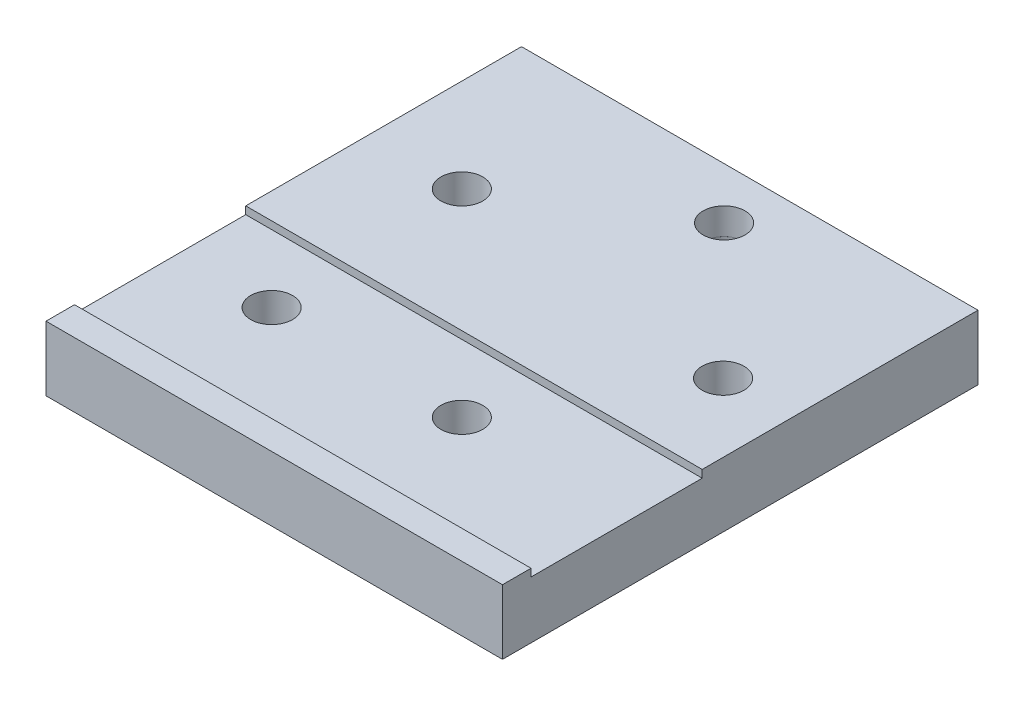
from build123d import *

# Parameters (mm, degrees)
SKETCH1_W           = 120
SKETCH1_H           = 55
BOSS_EXTRUDE1_DEPTH = 5
SKETCH2_W           = 120
SKETCH2_H           = 7.5
BOSS_EXTRUDE2_DEPTH = 20
SKETCH3_W           = 120
SKETCH3_H           = 2.5
BOSS_EXTRUDE4_DEPTH = 20
BOSS_EXTRUDE5_DEPTH = 190
SKETCH9_W           = 310
SKETCH9_H           = 25
BOSS_EXTRUDE6_DEPTH = 70
SKETCH14_R          = 5.5
CUT_EXTRUDE5_DEPTH  = 153
SKETCH15_W          = 125
SKETCH15_H          = 25
CUT_EXTRUDE6_DEPTH  = 190
SKETCH16_W          = 120
SKETCH16_H          = 125
BOSS_EXTRUDE8_DEPTH = 10
SKETCH17_W          = 120
SKETCH17_H          = 125
CUT_EXTRUDE7_DEPTH  = 18
CUT_EXTRUDE8_START  = -18
SKETCH18_R          = 5.5
CUT_EXTRUDE8_DEPTH  = 18
CUT_EXTRUDE9_START  = -47
SKETCH20_R          = 5.483938487
SKETCH20_R_2        = 5.5
CUT_EXTRUDE9_DEPTH  = 47
CUT_EXTRUDE10_START = -47
SKETCH21_R          = 5.5
CUT_EXTRUDE10_DEPTH = 47
CUT_EXTRUDE11_START = -47
SKETCH22_R          = 5.5
CUT_EXTRUDE11_DEPTH = 47


with BuildPart() as part:
    # Sketch1 → Boss-Extrude1 (new body)
    with BuildSketch(Plane(origin=(0, 0, 0), x_dir=(1, 0, 0), z_dir=(0, 1, 0))):
        Rectangle(SKETCH1_W, SKETCH1_H)
    extrude(amount=BOSS_EXTRUDE1_DEPTH)

    # Sketch2 → Boss-Extrude2 (add)
    with BuildSketch(Plane(origin=(0, 5, 0), x_dir=(1, 0, 0), z_dir=(0, 1, 0))):
        with Locations((0, -23.75)):
            Rectangle(SKETCH2_W, SKETCH2_H)
    extrude(amount=BOSS_EXTRUDE2_DEPTH)

    # Sketch3 → Boss-Extrude4 (add)
    with BuildSketch(Plane(origin=(0, 5, 0), x_dir=(1, 0, 0), z_dir=(0, 1, 0))):
        with Locations((0, 26.25)):
            Rectangle(SKETCH3_W, SKETCH3_H)
    extrude(amount=BOSS_EXTRUDE4_DEPTH)

    # Sketch8 → Boss-Extrude5 (add)
    with BuildSketch(Plane.ZY.offset(60)):
        Polygon((-27.5, 0), (-27.5, 25), (-25, 25), (-25, 5), (20, 5), (20, 25), (27.5, 25), (27.5, 0), align=None)
    extrude(amount=BOSS_EXTRUDE5_DEPTH)

    # Sketch9 → Boss-Extrude6 (add)
    with BuildSketch(Plane(origin=(0, 0, -27.5), x_dir=(-1, 0, 0), z_dir=(0, 0, -1))):
        with Locations((95, 12.5)):
            Rectangle(SKETCH9_W, SKETCH9_H)
    extrude(amount=BOSS_EXTRUDE6_DEPTH)

    # Sketch14 → Cut-Extrude5 (cut)
    with BuildSketch(Plane(origin=(0, 0, 0), x_dir=(-1, 0, 0), z_dir=(0, -1, 0))):
        with Locations(Location((225.445279058, 7.255161462, 0), (0, 0, 90))):
            Circle(SKETCH14_R)
        with Locations(Location((175.445279058, 7.255161462, 0), (0, 0, 90))):
            Circle(SKETCH14_R)
        with Locations(Location((225.445279058, 57.255161462, 0), (0, 0, 90))):
            Circle(SKETCH14_R)
        with Locations(Location((148.0182107, 48.5, 0), (0, 0, 90))):
            Circle(SKETCH14_R)
        with Locations(Location((183.240850763, 83.987541856, 0), (0, 0, 90))):
            Circle(SKETCH14_R)
    extrude(amount=-CUT_EXTRUDE5_DEPTH, mode=Mode.SUBTRACT)

    # Sketch15 → Cut-Extrude6 (cut)
    with BuildSketch(Plane(origin=(60, 0, 0), x_dir=(0, 0, -1), z_dir=(1, 0, 0))):
        with Locations((35, 12.5)):
            Rectangle(SKETCH15_W, SKETCH15_H)
    extrude(amount=-CUT_EXTRUDE6_DEPTH, mode=Mode.SUBTRACT)

    # Sketch16 → Boss-Extrude8 (add)
    with BuildSketch(Plane(origin=(0, 0, 0), x_dir=(-1, 0, 0), z_dir=(0, -1, 0))):
        with Locations((190, 35)):
            Rectangle(SKETCH16_W, SKETCH16_H)
    extrude(amount=BOSS_EXTRUDE8_DEPTH)

    # Sketch17 → Cut-Extrude7 (cut)
    with BuildSketch(Plane(origin=(0, 25, 0), x_dir=(1, 0, 0), z_dir=(0, 1, 0))):
        with Locations((-190, 35)):
            Rectangle(SKETCH17_W, SKETCH17_H)
    extrude(amount=-CUT_EXTRUDE7_DEPTH, mode=Mode.SUBTRACT)

    # Sketch18 → Cut-Extrude8 (cut)
    with BuildSketch(Plane(origin=(0, 7, 0), x_dir=(1, 0, 0), z_dir=(0, 1, 0)).offset(CUT_EXTRUDE8_START)):
        with Locations(Location((-148.0182107, 48.5, 0), (0, 0, 270))):
            Circle(SKETCH18_R)
    extrude(amount=CUT_EXTRUDE8_DEPTH, mode=Mode.SUBTRACT)

    # Sketch20 → Cut-Extrude9 (cut)
    with BuildSketch(Plane(origin=(0, 7, 0), x_dir=(1, 0, 0), z_dir=(0, 1, 0)).offset(CUT_EXTRUDE9_START)):
        with Locations(Location((-183.240850763, 83.987541856, 0), (0, 0, 270))):
            Circle(SKETCH20_R)
        with Locations(Location((-225.445279058, 57.255161462, 0), (0, 0, 270))):
            Circle(SKETCH20_R_2)
    extrude(amount=CUT_EXTRUDE9_DEPTH, mode=Mode.SUBTRACT)

    # Sketch21 → Cut-Extrude10 (cut)
    with BuildSketch(Plane(origin=(0, 5, 0), x_dir=(1, 0, 0), z_dir=(0, 1, 0)).offset(CUT_EXTRUDE10_START)):
        with Locations(Location((-225.445279058, 7.255161462, 0), (0, 0, 90))):
            Circle(SKETCH21_R)
    extrude(amount=CUT_EXTRUDE10_DEPTH, mode=Mode.SUBTRACT)

    # Sketch22 → Cut-Extrude11 (cut)
    with BuildSketch(Plane(origin=(0, 5, 0), x_dir=(1, 0, 0), z_dir=(0, 1, 0)).offset(CUT_EXTRUDE11_START)):
        with Locations(Location((-175.445279058, 7.255161462, 0), (0, 0, 90))):
            Circle(SKETCH22_R)
    extrude(amount=CUT_EXTRUDE11_DEPTH, mode=Mode.SUBTRACT)


solid = part.part
